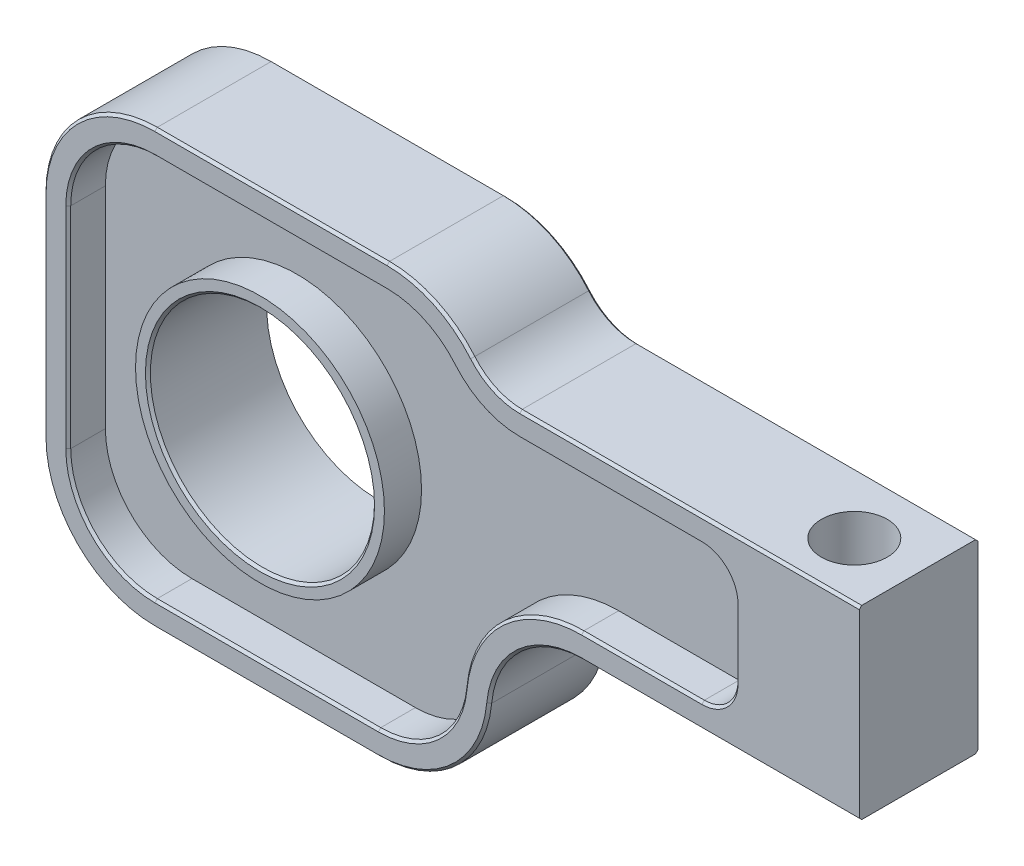
from build123d import *

# Parameters (mm, degrees)
SKETCH1_W           = 96.52
SKETCH1_H           = 44.45
BOSS_EXTRUDE1_DEPTH = 6.096
CUT_EXTRUDE1_REACH  = 108.961
SKETCH2_R           = 11.50874
CUT_EXTRUDE2_REACH  = 108.438
SKETCH3_R           = 3.3782
CUT_EXTRUDE3_REACH  = 108.961
SKETCH7_W           = 12.7635
SKETCH7_H           = 12.192
CUT_EXTRUDE5_DEPTH  = 104.946532487
FILLET1_R           = 11.43
SKETCH5_R           = 12.77874
CUT_EXTRUDE4_DEPTH  = 3.81
CHAMFER1_SIZE       = 0.254


with BuildPart() as part:
    # Sketch1 → Boss-Extrude1 (new, symmetric)
    with BuildSketch(Plane.XY):
        with Locations((48.26, -22.225)):
            Rectangle(SKETCH1_W, SKETCH1_H)
    extrude(amount=BOSS_EXTRUDE1_DEPTH, both=True)

    # Sketch2 → Cut-Extrude1 (cut, up to next)
    with BuildSketch(Plane.XY.offset(6.096), mode=Mode.PRIVATE) as cut_extrude1_sk1:
        with Locations((22.225, -22.225)):
            Circle(SKETCH2_R)
    cut_extrude1_tool1 = extrude(cut_extrude1_sk1.sketch, amount=-CUT_EXTRUDE1_REACH, mode=Mode.PRIVATE) & part.part
    add(cut_extrude1_tool1.solids().sort_by_distance((22.225, -22.225, 6.096))[0], mode=Mode.SUBTRACT)

    # Sketch3 → Cut-Extrude2 (cut, up to next)
    with BuildSketch(Plane(origin=(0, 0, 0), x_dir=(1, 0, 0), z_dir=(0, 1, 0)), mode=Mode.PRIVATE) as cut_extrude2_sk1:
        with Locations(Location((77.4065, -0.254, 0), (0, 0, 270))):
            Circle(SKETCH3_R)
    cut_extrude2_tool1 = extrude(cut_extrude2_sk1.sketch, amount=-CUT_EXTRUDE2_REACH, mode=Mode.PRIVATE) & part.part
    add(cut_extrude2_tool1.solids().sort_by_distance((77.4065, 0, 0.254))[0], mode=Mode.SUBTRACT)

    # Sketch4 → Cut-Extrude3 (cut, up to next)
    with BuildSketch(Plane.XY.offset(6.096), mode=Mode.PRIVATE) as cut_extrude3_sk1:
        with BuildLine():
            Line((48.895, 6.35), (96.52, 6.35))
            ThreePointArc((96.52, 6.35), (102.87, 0), (96.52, -6.35))
            Line((96.52, -6.35), (48.895, -6.35))
            ThreePointArc((48.895, -6.35), (42.545, 0), (48.895, 6.35))
        make_face()
    cut_extrude3_tool1 = extrude(cut_extrude3_sk1.sketch, amount=-CUT_EXTRUDE3_REACH, mode=Mode.PRIVATE) & part.part
    # Sketch4 → Cut-Extrude3 (cut, up to next)
    with BuildSketch(Plane.XY.offset(6.096), mode=Mode.PRIVATE) as cut_extrude3_sk2:
        with BuildLine():
            Line((45.72, -34.925), (45.72, -44.45))
            Line((45.72, -44.45), (55.245, -44.45))
            Line((55.245, -44.45), (96.52, -44.45))
            ThreePointArc((96.52, -44.45), (106.045, -34.925), (96.52, -25.4))
            Line((96.52, -25.4), (55.245, -25.4))
            ThreePointArc((55.245, -25.4), (48.509807909, -28.189807909), (45.72, -34.925))
        make_face()
    cut_extrude3_tool2 = extrude(cut_extrude3_sk2.sketch, amount=-CUT_EXTRUDE3_REACH, mode=Mode.PRIVATE) & part.part
    add(cut_extrude3_tool1.solids().sort_by_distance((72.7075, 0, 6.096))[0], mode=Mode.SUBTRACT)
    add(cut_extrude3_tool2.solids().sort_by_distance((75.382091, -35.05704, 6.096))[0], mode=Mode.SUBTRACT)

    # Sketch7 → Cut-Extrude5 (cut, through all)
    with BuildSketch(Plane(origin=(0, -6.35, 0), x_dir=(1, 0, 0), z_dir=(0, 1, 0))):
        with Locations((90.13825, 0)):
            Rectangle(SKETCH7_W, SKETCH7_H)
    extrude(amount=-CUT_EXTRUDE5_DEPTH, mode=Mode.SUBTRACT)

    # Fillet1
    fillet1_edges = [part.edges().sort_by_distance(p)[0] for p in [
        (42.545, 0, 0),
        (45.72, -44.45, 0),
        (0, -44.45, 0),
        (0, 0, 0),
    ]]
    fillet(fillet1_edges, radius=FILLET1_R)

    # Sketch5 → Cut-Extrude4 (cut)
    with BuildSketch(Plane.XY.offset(6.096)):
        with BuildLine():
            Line((71.0565, -12.3444), (71.0565, -19.4056))
            ThreePointArc((71.0565, -19.4056), (70.044729665, -21.848229665), (67.6021, -22.86))
            Line((67.6021, -22.86), (55.245, -22.86))
            ThreePointArc((55.245, -22.86), (47.110778659, -26.014406968), (43.229958807, -33.828181818))
            ThreePointArc((43.229958807, -33.828181818), (40.370407336, -39.585700129), (34.376770559, -41.91))
            Line((34.376770559, -41.91), (11.43, -41.91))
            ThreePointArc((11.43, -41.91), (5.143820715, -39.306179285), (2.54, -33.02))
            Line((2.54, -33.02), (2.54, -11.43))
            ThreePointArc((2.54, -11.43), (5.143820715, -5.143820715), (11.43, -2.54))
            Line((11.43, -2.54), (35.275767276, -2.54))
            ThreePointArc((35.275767276, -2.54), (39.032477938, -3.372753262), (42.085383638, -5.715))
            ThreePointArc((42.085383638, -5.715), (45.138289338, -8.057246738), (48.895, -8.89))
            Line((48.895, -8.89), (67.6021, -8.89))
            ThreePointArc((67.6021, -8.89), (70.044729665, -9.901770335), (71.0565, -12.3444))
        make_face()
        with Locations((22.225, -22.225)):
            Circle(SKETCH5_R, mode=Mode.SUBTRACT)
    cut_extrude4 = extrude(amount=-CUT_EXTRUDE4_DEPTH, mode=Mode.SUBTRACT)

    # Mirror3: Cut-Extrude4 across plane
    add(cut_extrude4.mirror(Plane.XY), mode=Mode.SUBTRACT)

    # Chamfer1
    chamfer1_edges = [part.edges().sort_by_distance(p)[0] for p in [
        (70.044729665, -21.848229665, 6.096),
        (71.0565, -15.875, 6.096),
        (70.044729665, -9.901770335, 6.096),
        (58.24855, -8.89, 6.096),
        (45.138289338, -8.057246738, 6.096),
        (39.032477938, -3.372753262, 6.096),
        (23.352883638, -2.54, 6.096),
        (5.143820715, -5.143820715, 6.096),
        (2.54, -22.225, 6.096),
        (5.143820715, -39.306179285, 6.096),
        (22.90338528, -41.91, 6.096),
        (40.370407336, -39.585700129, 6.096),
        (47.110778659, -26.014406968, 6.096),
        (61.42355, -22.86, 6.096),
        (10.71626, -22.225, 6.096),
        (70.044729665, -21.848229665, -6.096),
        (71.0565, -15.875, -6.096),
        (70.044729665, -9.901770335, -6.096),
        (58.24855, -8.89, -6.096),
        (45.138289338, -8.057246738, -6.096),
        (39.032477938, -3.372753262, -6.096),
        (23.352883638, -2.54, -6.096),
        (5.143820715, -5.143820715, -6.096),
        (2.54, -22.225, -6.096),
        (5.143820715, -39.306179285, -6.096),
        (22.90338528, -41.91, -6.096),
        (40.370407336, -39.585700129, -6.096),
        (47.110778659, -26.014406968, -6.096),
        (61.42355, -22.86, -6.096),
        (46.211635241, -5.755176242, -6.096),
        (66.32575, -6.35, 6.096),
        (69.50075, -25.4, -6.096),
        (48.82324631, -27.890321291, 6.096),
        (66.32575, -6.35, -6.096),
        (69.50075, -25.4, 6.096),
        (46.211635241, -5.755176242, 6.096),
        (23.352883638, 0, 6.096),
        (0, -22.225, 6.096),
        (22.90338528, -44.45, 6.096),
        (3.347769491, -3.347769491, 6.096),
        (3.347769491, -41.102230509, 6.096),
        (42.082874987, -41.461614451, 6.096),
        (40.105823841, -1.070682765, 6.096),
        (23.352883638, 0, -6.096),
        (48.82324631, -27.890321291, -6.096),
        (22.90338528, -44.45, -6.096),
        (0, -22.225, -6.096),
        (3.347769491, -3.347769491, -6.096),
        (3.347769491, -41.102230509, -6.096),
        (42.082874987, -41.461614451, -6.096),
        (40.105823841, -1.070682765, -6.096),
    ]]
    chamfer(chamfer1_edges, length=CHAMFER1_SIZE)


solid = part.part
